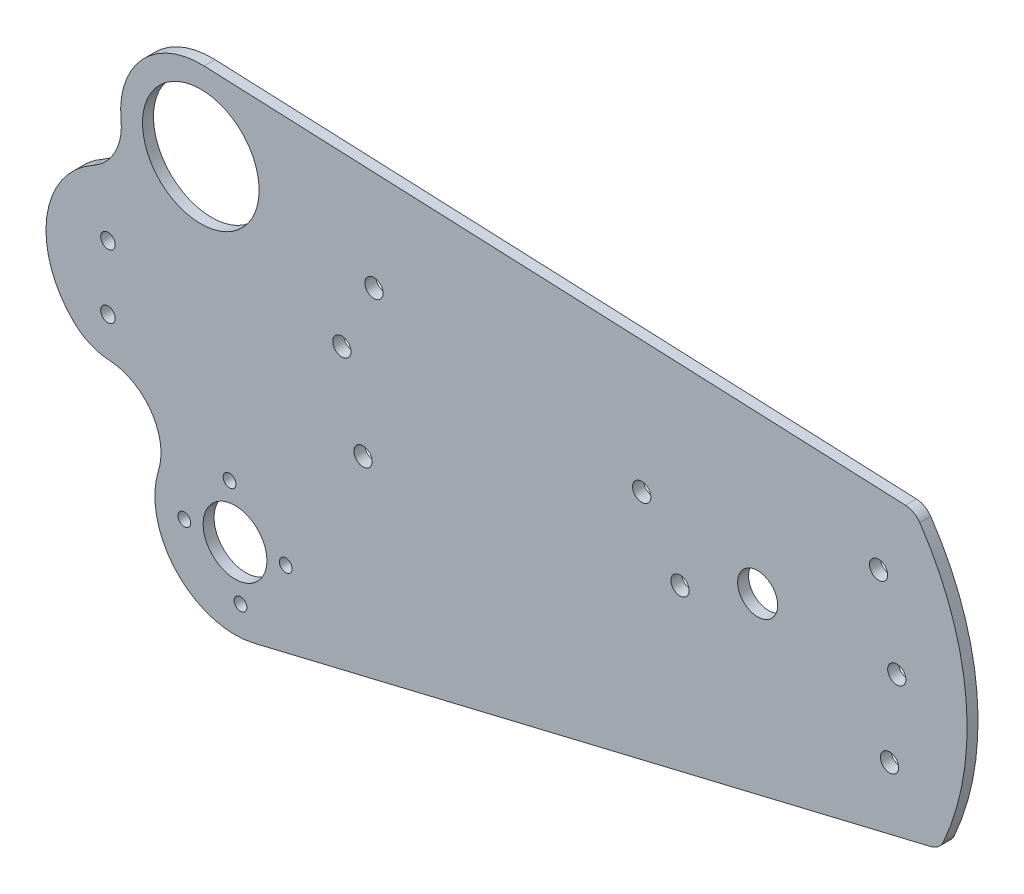
from build123d import *

# Parameters (mm, degrees)
SKETCH1_R           = 2
SKETCH1_R_2         = 2.5
SKETCH1_R_3         = 16
SKETCH1_R_4         = 5.5
SKETCH1_R_5         = 1.75
SKETCH1_R_6         = 8.75
BOSS_EXTRUDE1_DEPTH = 3


with BuildPart() as part:
    # Sketch1 → Boss-Extrude1 (new body)
    with BuildSketch(Plane.XY):
        with BuildLine():
            ThreePointArc((-111.886028634, 49.480245878), (-128.824449864, 42.592956949), (-134.705774542, 25.279526249))
            ThreePointArc((-134.705774542, 25.279526249), (-136.343375771, 16.802270376), (-142.382746132, 10.632050724))
            ThreePointArc((-142.382746132, 10.632050724), (-155.099864059, -8.058287742), (-147.542861296, -29.364285714))
            ThreePointArc((-147.542861296, -29.364285714), (-143.125485566, -32.280163581), (-137.970351553, -33.480224156))
            ThreePointArc((-137.970351553, -33.480224156), (-126.431132561, -39.888203569), (-124.422839539, -52.93360637))
            ThreePointArc((-124.422839539, -52.93360637), (-119.496486318, -74.51655299), (-98.295162907, -80.888085497))
            Line((-98.295162907, -80.888085497), (87.599861039, -36.324111832))
            ThreePointArc((87.599861039, -36.324111832), (89.628937626, -35.308169791), (91, -33.5))
            ThreePointArc((91, -33.5), (97.203558128, 3.661751943), (84.51565505, 39.137054004))
            ThreePointArc((84.51565505, 39.137054004), (82.813644384, 40.69192784), (80.594954641, 41.317938046))
            Line((80.594954641, 41.317938046), (-111.886028634, 49.480245878))
        make_face()
        with Locations((-138.3, -22.75)):
            Circle(SKETCH1_R, mode=Mode.SUBTRACT)
        with Locations((-68.3, -21.5)):
            Circle(SKETCH1_R_2, mode=Mode.SUBTRACT)
        with Locations((76.2, -22)):
            Circle(SKETCH1_R_2, mode=Mode.SUBTRACT)
        with Locations((-138.3, -5.25)):
            Circle(SKETCH1_R, mode=Mode.SUBTRACT)
        with Locations((-74.1, 1.7)):
            Circle(SKETCH1_R_2, mode=Mode.SUBTRACT)
        with Locations((-112.818118288, 27.5)):
            Circle(SKETCH1_R_3, mode=Mode.SUBTRACT)
        with Locations((-65.3, 20)):
            Circle(SKETCH1_R_2, mode=Mode.SUBTRACT)
        with Locations((18.7, -8.7)):
            Circle(SKETCH1_R_2, mode=Mode.SUBTRACT)
        with Locations((8.2, 8.3)):
            Circle(SKETCH1_R_2, mode=Mode.SUBTRACT)
        with Locations((40.017782272, 0)):
            Circle(SKETCH1_R_4, mode=Mode.SUBTRACT)
        with Locations((78.2, -0.1)):
            Circle(SKETCH1_R_2, mode=Mode.SUBTRACT)
        with Locations((73.2, 22.3)):
            Circle(SKETCH1_R_2, mode=Mode.SUBTRACT)
        with Locations((-104.926921956, -45.575160078)):
            Circle(SKETCH1_R_5, mode=Mode.SUBTRACT)
        with Locations((-101.920751925, -73.413316298)):
            Circle(SKETCH1_R_5, mode=Mode.SUBTRACT)
        with Locations((-117.342915051, -60.997323204)):
            Circle(SKETCH1_R_5, mode=Mode.SUBTRACT)
        with Locations((-103.42383694, -59.494238188)):
            Circle(SKETCH1_R_6, mode=Mode.SUBTRACT)
        with Locations((-89.50475883, -57.991153173)):
            Circle(SKETCH1_R_5, mode=Mode.SUBTRACT)
    extrude(amount=BOSS_EXTRUDE1_DEPTH)


solid = part.part
